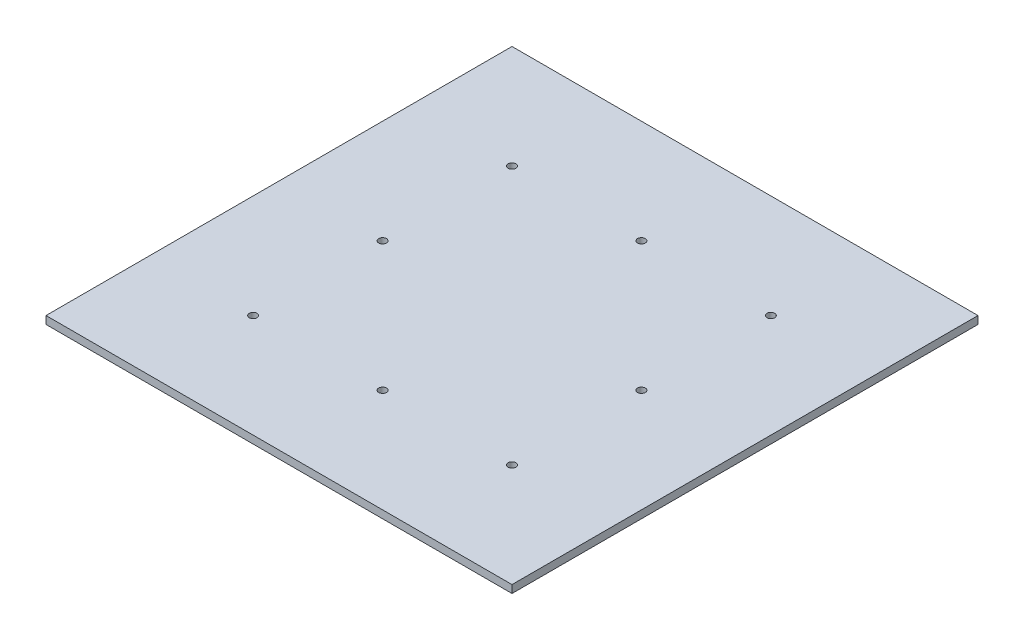
from build123d import *

# Parameters (mm, degrees)
SKETCH1_W           = 180
SKETCH1_H           = 180
BOSS_EXTRUDE1_DEPTH = 3
SKETCH2_R           = 1.5
CUT_EXTRUDE1_DEPTH  = 3


with BuildPart() as part:
    # Sketch1 → Boss-Extrude1 (new body)
    with BuildSketch(Plane(origin=(0, 0, 0), x_dir=(1, 0, 0), z_dir=(0, 1, 0))):
        with Locations((90, -90)):
            Rectangle(SKETCH1_W, SKETCH1_H)
    extrude(amount=BOSS_EXTRUDE1_DEPTH)

    # Sketch2 → Cut-Extrude1 (cut)
    with BuildSketch(Plane(origin=(0, 3, 0), x_dir=(1, 0, 0), z_dir=(0, 1, 0))):
        with Locations(Location((40, -40, 0), (0, 0, 270))):
            Circle(SKETCH2_R)
        with Locations(Location((140, -40, 0), (0, 0, 270))):
            Circle(SKETCH2_R)
        with Locations(Location((140, -140, 0), (0, 0, 270))):
            Circle(SKETCH2_R)
        with Locations(Location((40, -140, 0), (0, 0, 270))):
            Circle(SKETCH2_R)
        with Locations(Location((90, -40, 0), (0, 0, 270))):
            Circle(SKETCH2_R)
        with Locations(Location((140, -90, 0), (0, 0, 270))):
            Circle(SKETCH2_R)
        with Locations(Location((90, -140, 0), (0, 0, 270))):
            Circle(SKETCH2_R)
        with Locations(Location((40, -90, 0), (0, 0, 270))):
            Circle(SKETCH2_R)
    extrude(amount=-CUT_EXTRUDE1_DEPTH, mode=Mode.SUBTRACT)


solid = part.part
